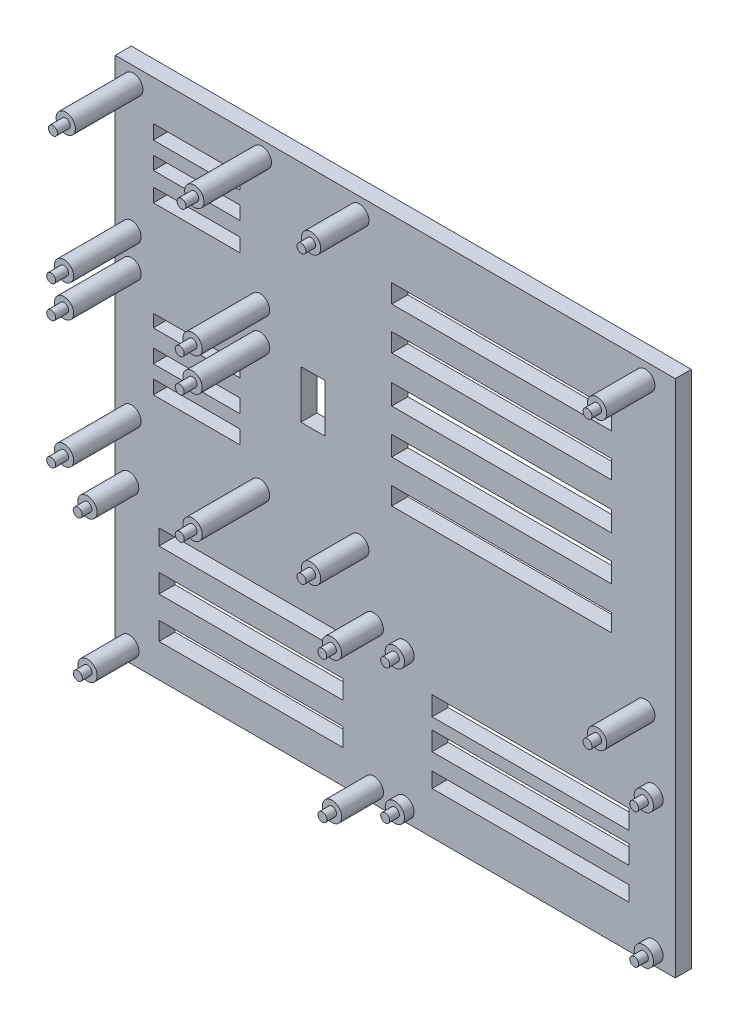
from build123d import *

# Parameters (mm, degrees)
SKETCH1_R            = 3
SKETCH1_W            = 57.32549759
SKETCH1_H            = 5.688771297
SKETCH1_H_2          = 5.842521873
SKETCH1_H_3          = 4.92001842
SKETCH1_W_2          = 26.922884564
SKETCH1_H_4          = 4.277382824
SKETCH1_W_3          = 61.334124095
SKETCH1_H_5          = 4.704767614
SKETCH1_H_6          = 5.974747368
SKETCH1_W_4          = 68.406104656
SKETCH1_H_7          = 5.494466237
SKETCH1_H_8          = 4.269416466
SKETCH1_H_9          = 3.943377121
SKETCH1_W_5          = 7.5
SKETCH1_H_10         = 15
SKETCH1_H_11         = 4.248368433
SKETCH1_H_12         = 4.139435909
SKETCH1_H_13         = 4.46623348
SKETCH1_H_14         = 6.107283804
SKETCH1_H_15         = 6.318636173
SKETCH1_H_16         = 5.769189549
SKETCH1_H_17         = 5.76918955
BOSS_EXTRUDE3_DEPTH  = 5
SKETCH1_6_R          = 3
BOSS_EXTRUDE4_DEPTH  = 26
SKETCH1_8_R          = 3
BOSS_EXTRUDE5_DEPTH  = 18
SKETCH1_10_R         = 3
BOSS_EXTRUDE6_DEPTH  = 8
SKETCH1_11_R         = 3
BOSS_EXTRUDE7_DEPTH  = 20
SKETCH1_12_R         = 1.4
BOSS_EXTRUDE8_DEPTH  = 30
SKETCH1_13_R         = 1.4
BOSS_EXTRUDE9_DEPTH  = 21
SKETCH1_15_R         = 1.4
BOSS_EXTRUDE10_DEPTH = 11
SKETCH1_16_R         = 1.4
BOSS_EXTRUDE11_DEPTH = 23


with BuildPart() as part:
    # Sketch1 → Boss-Extrude3 (new body)
    with BuildSketch(Plane.XY):
        Polygon((-20.116410516, 63.581349206), (-73.848571429, 63.581349206), (-73.848571429, -97.918650794), (100.383589484, -97.918650794), (100.383589484, -60.85880545), (100.383589484, -37.85880545), (100.383589484, 63.581349206), (2.883589484, 63.581349206), align=None)
        with Locations((-69.478571429, -93.418650794)):
            Circle(SKETCH1_R, mode=Mode.SUBTRACT)
        with Locations((-31.584870297, -84.690322091)):
            Rectangle(SKETCH1_W, SKETCH1_H, mode=Mode.SUBTRACT)
        with Locations((-31.584870297, -71.852149028)):
            Rectangle(SKETCH1_W, SKETCH1_H_2, mode=Mode.SUBTRACT)
        with Locations((-31.584870297, -59.398352403)):
            Rectangle(SKETCH1_W, SKETCH1_H_3, mode=Mode.SUBTRACT)
        with Locations((6.601428571, -93.418650794)):
            Circle(SKETCH1_R, mode=Mode.SUBTRACT)
        with Locations((16.141428571, -93.878650794)):
            Circle(SKETCH1_R, mode=Mode.SUBTRACT)
        with Locations((-69.523792896, -49.418650794)):
            Circle(SKETCH1_R, mode=Mode.SUBTRACT)
        with Locations((-68.788571429, -31.080828543)):
            Circle(SKETCH1_R, mode=Mode.SUBTRACT)
        with Locations((-28.788571429, -31.080828543)):
            Circle(SKETCH1_R, mode=Mode.SUBTRACT)
        with Locations((-48.537699589, -19.846770176)):
            Rectangle(SKETCH1_W_2, SKETCH1_H_4, mode=Mode.SUBTRACT)
        with Locations((6.556207104, -49.418674032)):
            Circle(SKETCH1_R, mode=Mode.SUBTRACT)
        with Locations((16.141428571, -51.968650794)):
            Circle(SKETCH1_R, mode=Mode.SUBTRACT)
        with Locations((2.071428571, -30.498650794)):
            Circle(SKETCH1_R, mode=Mode.SUBTRACT)
        with Locations((55.384741084, -82.337938284)):
            Rectangle(SKETCH1_W_3, SKETCH1_H_5, mode=Mode.SUBTRACT)
        with Locations((55.384741084, -71.852149028)):
            Rectangle(SKETCH1_W_3, SKETCH1_H_2, mode=Mode.SUBTRACT)
        with Locations((55.384741084, -62.385726087)):
            Rectangle(SKETCH1_W_3, SKETCH1_H_6, mode=Mode.SUBTRACT)
        with Locations((93.611428571, -93.878650794)):
            Circle(SKETCH1_R, mode=Mode.SUBTRACT)
        with Locations((46.379204663, -12.094485759)):
            Rectangle(SKETCH1_W_4, SKETCH1_H_7, mode=Mode.SUBTRACT)
        with Locations((93.611428571, -51.968650794)):
            Circle(SKETCH1_R, mode=Mode.SUBTRACT)
        with Locations((91.071428571, -30.498650794)):
            Circle(SKETCH1_R, mode=Mode.SUBTRACT)
        with Locations((-68.788571429, 8.581349206)):
            Circle(SKETCH1_R, mode=Mode.SUBTRACT)
        with Locations((-48.537699589, -11.481960873)):
            Rectangle(SKETCH1_W_2, SKETCH1_H_8, mode=Mode.SUBTRACT)
        with Locations((-48.537699589, -1.971688561)):
            Rectangle(SKETCH1_W_2, SKETCH1_H_9, mode=Mode.SUBTRACT)
        with Locations((-28.788571429, 8.581349206)):
            Circle(SKETCH1_R, mode=Mode.SUBTRACT)
        with Locations((-68.788571429, 18.581349206)):
            Circle(SKETCH1_R, mode=Mode.SUBTRACT)
        with Locations((-28.788571429, 18.91917133)):
            Circle(SKETCH1_R, mode=Mode.SUBTRACT)
        with Locations((-12.366410516, 1.081349206)):
            Rectangle(SKETCH1_W_5, SKETCH1_H_10, mode=Mode.SUBTRACT)
        with Locations((-48.537699589, 31.881415248)):
            Rectangle(SKETCH1_W_2, SKETCH1_H_11, mode=Mode.SUBTRACT)
        with Locations((-48.537699589, 40.541550899)):
            Rectangle(SKETCH1_W_2, SKETCH1_H_12, mode=Mode.SUBTRACT)
        with Locations((-48.537699589, 48.874888978)):
            Rectangle(SKETCH1_W_2, SKETCH1_H_13, mode=Mode.SUBTRACT)
        with Locations((-68.248571429, 58.581349206)):
            Circle(SKETCH1_R, mode=Mode.SUBTRACT)
        with Locations((-28.248571429, 58.91917133)):
            Circle(SKETCH1_R, mode=Mode.SUBTRACT)
        with Locations((2.071428571, 58.501349206)):
            Circle(SKETCH1_R, mode=Mode.SUBTRACT)
        with Locations((46.379204663, 1.398641994)):
            Rectangle(SKETCH1_W_4, SKETCH1_H_14, mode=Mode.SUBTRACT)
        with Locations((46.379204663, 15.240483772)):
            Rectangle(SKETCH1_W_4, SKETCH1_H_15, mode=Mode.SUBTRACT)
        with Locations((46.379204663, 29.251372679)):
            Rectangle(SKETCH1_W_4, SKETCH1_H_16, mode=Mode.SUBTRACT)
        with Locations((46.379204663, 42.438091648)):
            Rectangle(SKETCH1_W_4, SKETCH1_H_17, mode=Mode.SUBTRACT)
        with Locations((91.071428571, 58.501349206)):
            Circle(SKETCH1_R, mode=Mode.SUBTRACT)
    extrude(amount=BOSS_EXTRUDE3_DEPTH)

    # Sketch1<6> → Boss-Extrude4 (add)
    with BuildSketch(Plane.XY):
        with Locations((-28.788571429, -31.080828543)):
            Circle(SKETCH1_6_R)
        with Locations((-68.788571429, -31.080828543)):
            Circle(SKETCH1_6_R)
        with Locations((-68.788571429, 8.581349206)):
            Circle(SKETCH1_6_R)
        with Locations((-28.788571429, 8.581349206)):
            Circle(SKETCH1_6_R)
        with Locations((-28.788571429, 18.91917133)):
            Circle(SKETCH1_6_R)
        with Locations((-68.788571429, 18.581349206)):
            Circle(SKETCH1_6_R)
        with Locations((-68.248571429, 58.581349206)):
            Circle(SKETCH1_6_R)
        with Locations((-28.248571429, 58.91917133)):
            Circle(SKETCH1_6_R)
    extrude(amount=BOSS_EXTRUDE4_DEPTH)

    # Sketch1<8> → Boss-Extrude5 (add)
    with BuildSketch(Plane.XY):
        with Locations((6.601428571, -93.418650794)):
            Circle(SKETCH1_8_R)
        with Locations((6.556207104, -49.418674032)):
            Circle(SKETCH1_8_R)
        with Locations((-69.523792896, -49.418650794)):
            Circle(SKETCH1_8_R)
        with Locations((-69.478571429, -93.418650794)):
            Circle(SKETCH1_8_R)
    extrude(amount=BOSS_EXTRUDE5_DEPTH)

    # Sketch1<10> → Boss-Extrude6 (add)
    with BuildSketch(Plane.XY):
        with Locations((93.611428571, -93.878650794)):
            Circle(SKETCH1_10_R)
        with Locations((93.611428571, -51.968650794)):
            Circle(SKETCH1_10_R)
        with Locations((16.141428571, -51.968650794)):
            Circle(SKETCH1_10_R)
        with Locations((16.141428571, -93.878650794)):
            Circle(SKETCH1_10_R)
    extrude(amount=BOSS_EXTRUDE6_DEPTH)

    # Sketch1<11> → Boss-Extrude7 (add)
    with BuildSketch(Plane.XY):
        with Locations((91.071428571, 58.501349206)):
            Circle(SKETCH1_11_R)
        with Locations((2.071428571, 58.501349206)):
            Circle(SKETCH1_11_R)
        with Locations((2.071428571, -30.498650794)):
            Circle(SKETCH1_11_R)
        with Locations((91.071428571, -30.498650794)):
            Circle(SKETCH1_11_R)
    extrude(amount=BOSS_EXTRUDE7_DEPTH)

    # Sketch1<12> → Boss-Extrude8 (add)
    with BuildSketch(Plane.XY):
        with Locations((-28.788571429, -31.080828543)):
            Circle(SKETCH1_12_R)
        with Locations((-68.788571429, -31.080828543)):
            Circle(SKETCH1_12_R)
        with Locations((-68.788571429, 8.581349206)):
            Circle(SKETCH1_12_R)
        with Locations((-68.788571429, 18.581349206)):
            Circle(SKETCH1_12_R)
        with Locations((-28.788571429, 18.91917133)):
            Circle(SKETCH1_12_R)
        with Locations((-68.248571429, 58.581349206)):
            Circle(SKETCH1_12_R)
        with Locations((-28.248571429, 58.91917133)):
            Circle(SKETCH1_12_R)
        with Locations((-28.788571429, 8.581349206)):
            Circle(SKETCH1_12_R)
    extrude(amount=BOSS_EXTRUDE8_DEPTH)

    # Sketch1<13> → Boss-Extrude9 (add)
    with BuildSketch(Plane.XY):
        with Locations((6.556207104, -49.418674032)):
            Circle(SKETCH1_13_R)
        with Locations((6.601428571, -93.418650794)):
            Circle(SKETCH1_13_R)
        with Locations((-69.523792896, -49.418650794)):
            Circle(SKETCH1_13_R)
        with Locations((-69.478571429, -93.418650794)):
            Circle(SKETCH1_13_R)
    extrude(amount=BOSS_EXTRUDE9_DEPTH)

    # Sketch1<15> → Boss-Extrude10 (add)
    with BuildSketch(Plane.XY):
        with Locations((93.611428571, -51.968650794)):
            Circle(SKETCH1_15_R)
        with Locations((93.611428571, -93.878650794)):
            Circle(SKETCH1_15_R)
        with Locations((16.141428571, -93.878650794)):
            Circle(SKETCH1_15_R)
        with Locations((16.141428571, -51.968650794)):
            Circle(SKETCH1_15_R)
    extrude(amount=BOSS_EXTRUDE10_DEPTH)

    # Sketch1<16> → Boss-Extrude11 (add)
    with BuildSketch(Plane.XY):
        with Locations((91.071428571, 58.501349206)):
            Circle(SKETCH1_16_R)
        with Locations((91.071428571, -30.498650794)):
            Circle(SKETCH1_16_R)
        with Locations((2.071428571, -30.498650794)):
            Circle(SKETCH1_16_R)
        with Locations((2.071428571, 58.501349206)):
            Circle(SKETCH1_16_R)
    extrude(amount=BOSS_EXTRUDE11_DEPTH)


solid = part.part
